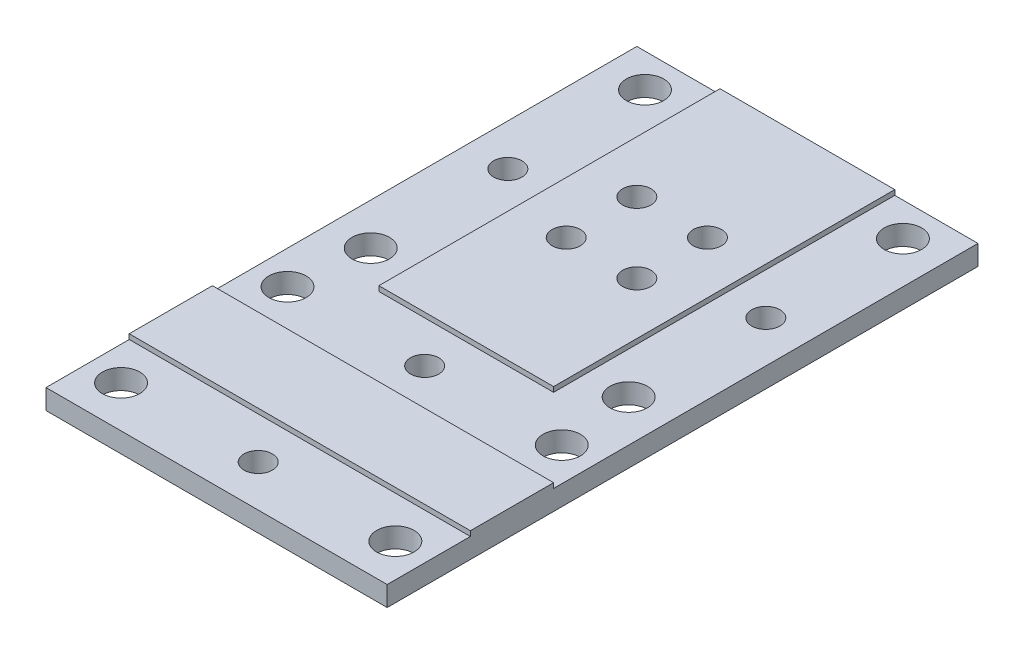
from build123d import *

# Parameters (mm, degrees)
SKETCH_1_W          = 41
SKETCH_1_H          = 71
EXTRUDE_1_DEPTH     = 3
SKETCH_2_W          = 41
SKETCH_2_H          = 10
CUT_EXTRUDE_1_DEPTH = 0.6
HOLE_WIZARD_M41_D   = 4.5
HOLE_WIZARD_M31_D   = 3.4
HOLE_WIZARD_M32_D   = 3.4


with BuildPart() as part:
    # Эскиз1 → Бобышка-Вытянуть1 (new body)
    with BuildSketch(Plane(origin=(0, 0, 0), x_dir=(1, 0, 0), z_dir=(0, 1, 0))):
        with Locations((20.5, 35.5)):
            Rectangle(SKETCH_1_W, SKETCH_1_H)
    extrude(amount=EXTRUDE_1_DEPTH)

    # Эскиз2 → Вырез-Вытянуть1 (cut)
    with BuildSketch(Plane(origin=(0, 3, 0), x_dir=(1, 0, 0), z_dir=(0, 1, 0))):
        with Locations((20.5, 5)):
            Rectangle(SKETCH_2_W, SKETCH_2_H)
        Polygon((0, 71), (10, 71), (10, 30), (31, 30), (31, 71), (41, 71), (41, 30), (41, 20), (0, 20), (0, 30), align=None)
    extrude(amount=-CUT_EXTRUDE_1_DEPTH, mode=Mode.SUBTRACT)

    # Отверстие с зазором M41 (through all)
    with Locations(Plane(origin=(24.31748925, 3, -29.970792186), x_dir=(1, 0, 0), z_dir=(0, 1, 0))):
        with Locations((-20.297457148, -24.970792186), (12.662478647, -24.970792186), (12.662478647, -4.970792186), (-20.297457148, -4.970792186), (-19.31748925, 4.049239917), (11.68251075, 4.049239917), (11.68251075, 37.009175711), (-19.31748925, 37.009175711)):
            Hole(HOLE_WIZARD_M41_D / 2)

    # Отверстие с зазором M31 (through all)
    with Locations(Plane(origin=(24.31748925, 3, -29.970792186), x_dir=(1, 0, 0), z_dir=(0, 1, 0))):
        with Locations((-3.81748925, -24.970792186), (-3.81748925, -4.970792186), (-19.31748925, 20.529207814), (11.68251075, 20.529207814)):
            Hole(HOLE_WIZARD_M31_D / 2)

    # Отверстие с зазором M32 (through all)
    with Locations(Plane(origin=(0, 3, 0), x_dir=(1, 0, 0), z_dir=(0, 1, 0))):
        with Locations((16.257359313, 46.257359313), (16.257359313, 54.742640687), (24.742640687, 54.742640687), (24.742640687, 46.257359313)):
            Hole(HOLE_WIZARD_M32_D / 2)


solid = part.part
